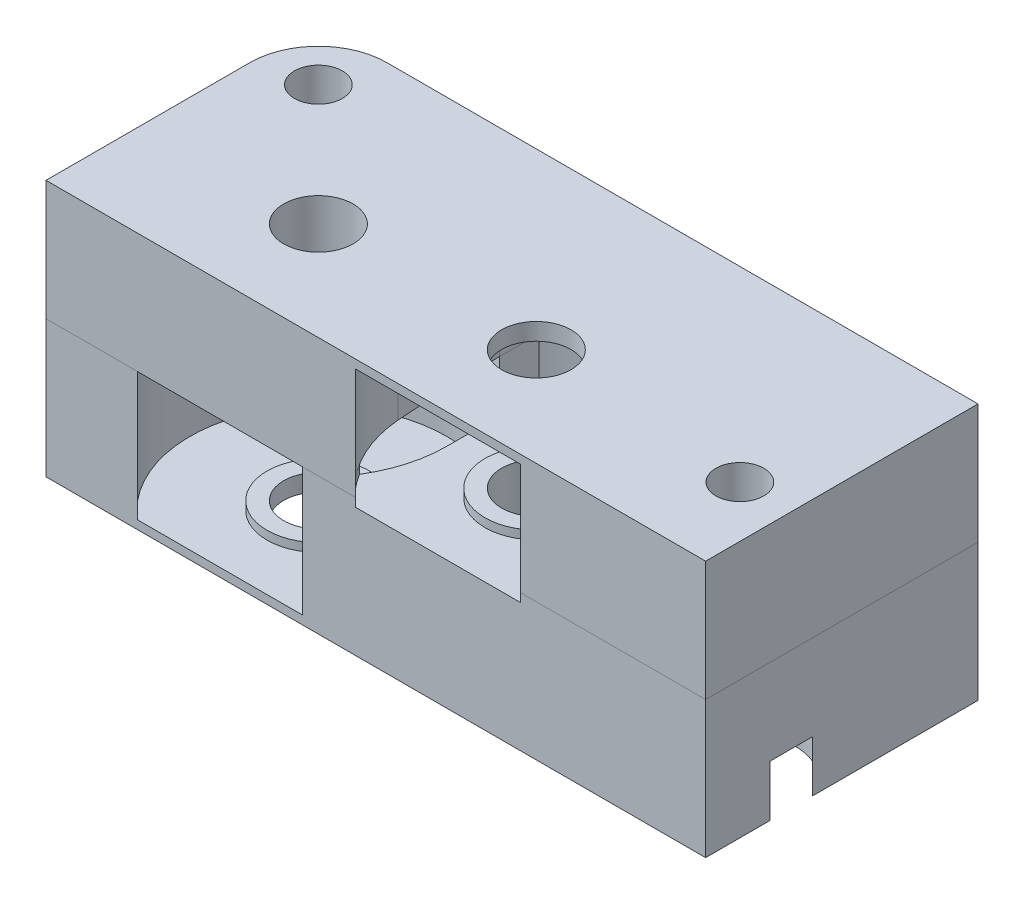
from build123d import *

# Parameters (mm, degrees)
SKETCH1_W                     = 38.53
SKETCH1_H                     = 15.91
SKETCH1_R                     = 2.025
BOSS_EXTRUDE1_DEPTH           = 8
CUT_EXTRUDE1_DEPTH            = 7
SKETCH3_R                     = 3
CUT_EXTRUDE2_DEPTH            = 0.5
SKETCH5_R                     = 3
CUT_EXTRUDE4_DEPTH            = 0.5
SKETCH8_R                     = 2.025
BOSS_EXTRUDE3_DEPTH           = 6
BOSS_EXTRUDE3_2_DEPTH         = 6
BOSS_EXTRUDE5_START           = 1
SKETCH12_R                    = 2.025
BOSS_EXTRUDE5_DEPTH           = 1
SKETCH13_R                    = 3.025
CUT_EXTRUDE6_DEPTH            = 0.5
SKETCH14_W                    = 38.53
SKETCH14_H                    = 15.91
SKETCH14_R                    = 2.025
BOSS_EXTRUDE6_DEPTH           = 1
CUT_EXTRUDE7_START            = -0.5
SKETCH15_R                    = 3
CUT_EXTRUDE7_DEPTH            = 0.5
FILLET1_R                     = 4
FILLET2_R                     = 4
SKETCH23_R                    = 1.4
CUT_EXTRUDE13_DEPTH           = 43.44630726
CBORE_FOR_M3_SHCS1_AT_2_COUNT = 2
CBORE_FOR_M3_SHCS1_AT_2_PITCH = 33.337733301


with BuildPart() as part:
    # Sketch1 → Boss-Extrude1 (new body)
    with BuildSketch(Plane(origin=(0, 0, 0), x_dir=(1, 0, 0), z_dir=(0, 1, 0))):
        with Locations((19.265, 7.955)):
            Rectangle(SKETCH1_W, SKETCH1_H)
        with Locations(Location((10.16, 5.75, 0), (0, 0, 270))):
            Circle(SKETCH1_R, mode=Mode.SUBTRACT)
        with Locations(Location((22.89, 5.75, 0), (0, 0, 270))):
            Circle(SKETCH1_R, mode=Mode.SUBTRACT)
    extrude(amount=BOSS_EXTRUDE1_DEPTH)

    # Sketch2 → Cut-Extrude1 (cut)
    with BuildSketch(Plane(origin=(0, 8, 0), x_dir=(1, 0, 0), z_dir=(0, 1, 0))):
        with BuildLine():
            Line((17.66, 5.75), (17.66, 15.91))
            Line((17.66, 15.91), (15.16, 15.91))
            Line((15.16, 15.91), (15.16, 11.340169944))
            ThreePointArc((15.16, 11.340169944), (4.489163341, 10.658320649), (5.344659929, 0))
            Line((5.344659929, 0), (0, 0))
            Line((0, 0), (0, -1.75))
            Line((0, -1.75), (10.16, -1.75))
            ThreePointArc((10.16, -1.75), (15.463300859, 0.446699141), (17.66, 5.75))
        make_face()
    extrude(amount=-CUT_EXTRUDE1_DEPTH, mode=Mode.SUBTRACT)

    # Sketch3 → Cut-Extrude2 (cut)
    with BuildSketch(Plane(origin=(0, 1, 0), x_dir=(1, 0, 0), z_dir=(0, 1, 0))):
        with BuildLine():
            Line((17.66, 5.75), (17.66, 15.91))
            Line((17.66, 15.91), (15.16, 15.91))
            Line((15.16, 15.91), (15.16, 11.340169944))
            ThreePointArc((15.16, 11.340169944), (4.489163341, 10.658320649), (5.344659929, 0))
            Line((5.344659929, 0), (14.975340071, 0))
            ThreePointArc((14.975340071, 0), (16.955772603, 2.577071584), (17.66, 5.75))
        make_face()
        with Locations(Location((10.16, 5.75, 0), (0, 0, 270))):
            Circle(SKETCH3_R, mode=Mode.SUBTRACT)
    extrude(amount=-CUT_EXTRUDE2_DEPTH, mode=Mode.SUBTRACT)

    # Sketch5 → Cut-Extrude4 (cut)
    with BuildSketch(Plane(origin=(0, 8, 0), x_dir=(1, 0, 0), z_dir=(0, 1, 0))):
        with BuildLine():
            Line((17.66, 11.125602292), (17.66, 5.75))
            ThreePointArc((17.66, 5.75), (17.370669178, 3.686931896), (16.525, 1.783039577))
            ThreePointArc((16.525, 1.783039577), (30.33525861, 4.845497801), (17.66, 11.125602292))
        make_face()
        with Locations(Location((22.89, 5.75, 0), (0, 0, 270))):
            Circle(SKETCH5_R, mode=Mode.SUBTRACT)
    extrude(amount=-CUT_EXTRUDE4_DEPTH, mode=Mode.SUBTRACT)

    # Fillet2
    fillet2_edges = [part.edges().sort_by_distance(p)[0] for p in [
        (0, 4, -15.91),
    ]]
    fillet(fillet2_edges, radius=FILLET2_R)


with BuildPart() as body_2:
    # Sketch8 → Boss-Extrude3 (new body)
    with BuildSketch(Plane(origin=(0, 8, 0), x_dir=(1, 0, 0), z_dir=(0, 1, 0))):
        with BuildLine():
            Line((0, 0), (18.074659929, 0))
            ThreePointArc((18.074659929, 0), (16.230407552, 2.300387207), (15.415349089, 5.133888192))
            ThreePointArc((15.415349089, 5.133888192), (15.223864265, 8.23440368), (15.16, 11.340169944))
            Line((15.16, 11.340169944), (15.16, 15.91))
            Line((15.16, 15.91), (0, 15.91))
            Line((0, 15.91), (0, 0))
        make_face()
        with Locations(Location((10.16, 5.75, 0), (0, 0, 90))):
            Circle(SKETCH8_R, mode=Mode.SUBTRACT)
    extrude(amount=BOSS_EXTRUDE3_DEPTH)

    # Sketch12 → Boss-Extrude5 (add)
    with BuildSketch(Plane.XZ.offset(-8).offset(BOSS_EXTRUDE5_START)):
        with BuildLine():
            Line((13.992427429, -0.5), (6.327572571, -0.5))
            ThreePointArc((6.327572571, -0.5), (5.180995333, -9.928458152), (14.665384101, -10.435244295))
            ThreePointArc((14.665384101, -10.435244295), (14.744232393, -7.761816232), (14.917039028, -5.092814072))
            ThreePointArc((14.917039028, -5.092814072), (15.166862315, -3.663580986), (15.670718775, -2.302975401))
            ThreePointArc((15.670718775, -2.302975401), (14.917759485, -1.321261502), (13.992427429, -0.5))
        make_face()
        with Locations(Location((10.16, -5.75, 0), (0, 0, 270))):
            Circle(SKETCH12_R, mode=Mode.SUBTRACT)
    extrude(amount=-BOSS_EXTRUDE5_DEPTH)

    # Sketch13 → Cut-Extrude6 (cut)
    with BuildSketch(Plane.XZ.offset(-7)):
        with BuildLine():
            Line((13.992427429, -0.5), (6.327572571, -0.5))
            ThreePointArc((6.327572571, -0.5), (5.180995333, -9.928458152), (14.665384101, -10.435244295))
            ThreePointArc((14.665384101, -10.435244295), (14.744232393, -7.761816232), (14.917039028, -5.092814072))
            ThreePointArc((14.917039028, -5.092814072), (15.166862315, -3.663580986), (15.670718775, -2.302975401))
            ThreePointArc((15.670718775, -2.302975401), (14.917759485, -1.321261502), (13.992427429, -0.5))
        make_face()
        with Locations(Location((10.16, -5.75, 0), (0, 0, 270))):
            Circle(SKETCH13_R, mode=Mode.SUBTRACT)
    extrude(amount=-CUT_EXTRUDE6_DEPTH, mode=Mode.SUBTRACT)



with BuildPart() as body_3:
    # Sketch8 → Boss-Extrude3 2 (new body)
    with BuildSketch(Plane(origin=(0, 8, 0), x_dir=(1, 0, 0), z_dir=(0, 1, 0))):
        with BuildLine():
            Line((27.705340071, 0), (38.53, 0))
            Line((38.53, 0), (38.53, 15.91))
            Line((38.53, 15.91), (17.66, 15.91))
            Line((17.66, 15.91), (17.66, 11.125602292))
            ThreePointArc((17.66, 11.125602292), (28.45666348, 10.776157349), (27.705340071, 0))
        make_face()
    extrude(amount=BOSS_EXTRUDE3_2_DEPTH)


with BuildPart() as body_2_1:
    add(body_2.part)

    add(body_3.part)  # Boss-Extrude6 merges body 3
    # Sketch14 → Boss-Extrude6 (add)
    with BuildSketch(Plane(origin=(0, 14, 0), x_dir=(1, 0, 0), z_dir=(0, 1, 0))):
        with Locations((19.265, 7.955)):
            Rectangle(SKETCH14_W, SKETCH14_H)
        with Locations(Location((22.89, 5.75, 0), (0, 0, 270))):
            Circle(SKETCH14_R, mode=Mode.SUBTRACT)
        with Locations(Location((10.16, 5.75, 0), (0, 0, 90))):
            Circle(SKETCH14_R, mode=Mode.SUBTRACT)
    extrude(amount=BOSS_EXTRUDE6_DEPTH)

    # Sketch15 → Cut-Extrude7 (cut)
    with BuildSketch(Plane.XZ.offset(-14).offset(CUT_EXTRUDE7_START)):
        with BuildLine():
            Line((15.16, -11.340169944), (15.16, -15.91))
            Line((15.16, -15.91), (17.66, -15.91))
            Line((17.66, -15.91), (17.66, -11.125602292))
            ThreePointArc((17.66, -11.125602292), (28.45666348, -10.776157349), (27.705340071, 0))
            Line((27.705340071, 0), (18.074659929, 0))
            ThreePointArc((18.074659929, 0), (16.230407552, -2.300387207), (15.415349089, -5.133888192))
            ThreePointArc((15.415349089, -5.133888192), (15.223864265, -8.23440368), (15.16, -11.340169944))
        make_face()
        with Locations(Location((22.89, -5.75, 0), (0, 0, 270))):
            Circle(SKETCH15_R, mode=Mode.SUBTRACT)
    extrude(amount=CUT_EXTRUDE7_DEPTH, mode=Mode.SUBTRACT)

    # Fillet1
    fillet1_edges = [body_2_1.edges().sort_by_distance(p)[0] for p in [
        (0, 11.5, -15.91),
    ]]
    fillet(fillet1_edges, radius=FILLET1_R)

    # Sketch23 → Cut-Extrude13 (cut, through all)
    with BuildSketch(Plane.XZ.offset(-8)):
        with Locations(Location((3.116116524, -12.793883476, 0), (0, 0, 270))):
            Circle(SKETCH23_R)
        with Locations(Location((35.53, -5, 0), (0, 0, 270))):
            Circle(SKETCH23_R)
    extrude(amount=-CUT_EXTRUDE13_DEPTH, mode=Mode.SUBTRACT)


with BuildPart() as cbore_for_m3_shcs1_tool:
    # Sketch25 → CBORE for M3 SHCS1 (revolve)
    with BuildSketch(Plane(origin=(35.53, 0, -5), x_dir=(0, 0, -1), z_dir=(1, 0, 0))):
        Polygon((0, 0), (0, 9.020463052), (1.7, 7.999), (1.7, 3), (3.25, 3), (3.25, 0), align=None)
    cbore_for_m3_shcs1 = revolve(axis=Axis((35.53, -6.35, -5), (0, 1, 0)))


with BuildPart() as part_1:
    add(part.part)

    # CBORE for M3 SHCS1: cut by cbore_for_m3_shcs1_tool
    add(cbore_for_m3_shcs1_tool.part, mode=Mode.SUBTRACT)


with BuildPart() as body_2_2:
    add(body_2_1.part)

    # CBORE for M3 SHCS1: cut by cbore_for_m3_shcs1_tool
    add(cbore_for_m3_shcs1_tool.part, mode=Mode.SUBTRACT)


with BuildPart() as cbore_for_m3_shcs1_at_2_tool:
    # CBORE for M3 SHCS1 at 2: CBORE for M3 SHCS1 ×2
    with Locations(*[Vector(-0.9722881631898271, 0, -0.2337856448136884) * (i * CBORE_FOR_M3_SHCS1_AT_2_PITCH) for i in range(1, CBORE_FOR_M3_SHCS1_AT_2_COUNT)]):
        add(cbore_for_m3_shcs1)


with BuildPart() as part_2:
    add(part_1.part)

    # CBORE for M3 SHCS1 at 2: cut by cbore_for_m3_shcs1_at_2_tool
    add(cbore_for_m3_shcs1_at_2_tool.part, mode=Mode.SUBTRACT)


with BuildPart() as body_2_3:
    add(body_2_2.part)

    # CBORE for M3 SHCS1 at 2: cut by cbore_for_m3_shcs1_at_2_tool
    add(cbore_for_m3_shcs1_at_2_tool.part, mode=Mode.SUBTRACT)


solid = Compound([part_2.part, body_2_3.part])
